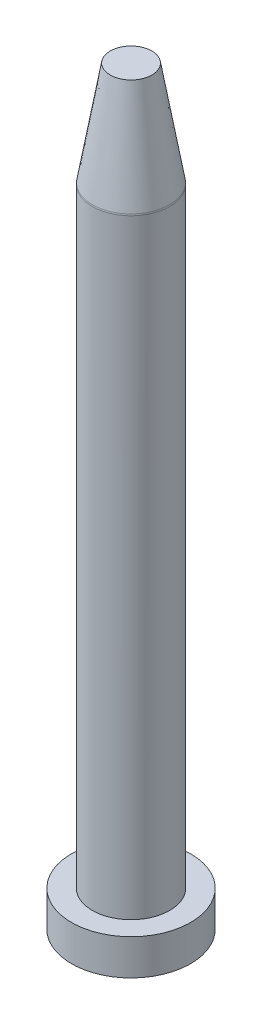
from build123d import *

# Parameters (mm, degrees)
FILLET_1_R = 3


with BuildPart() as part:
    # 草图1 → Revolve 333 (revolve)
    with BuildSketch(Plane.XY, mode=Mode.PRIVATE) as revolve_333_sk:
        Polygon((0, 0), (20, 0), (20, 12), (13, 12), (13, 217), (7, 252), (0, 252), align=None)
    revolve(revolve_333_sk.sketch.rotate(Axis((0, 0, 0), (0, 1, 0)), 90), axis=Axis((0, 0, 0), (0, 1, 0)))

    # 圆角1
    fillet_1_edges = [part.edges().sort_by_distance(p)[0] for p in [
        (0, 217, 13),
    ]]
    fillet(fillet_1_edges, radius=FILLET_1_R)


solid = part.part
